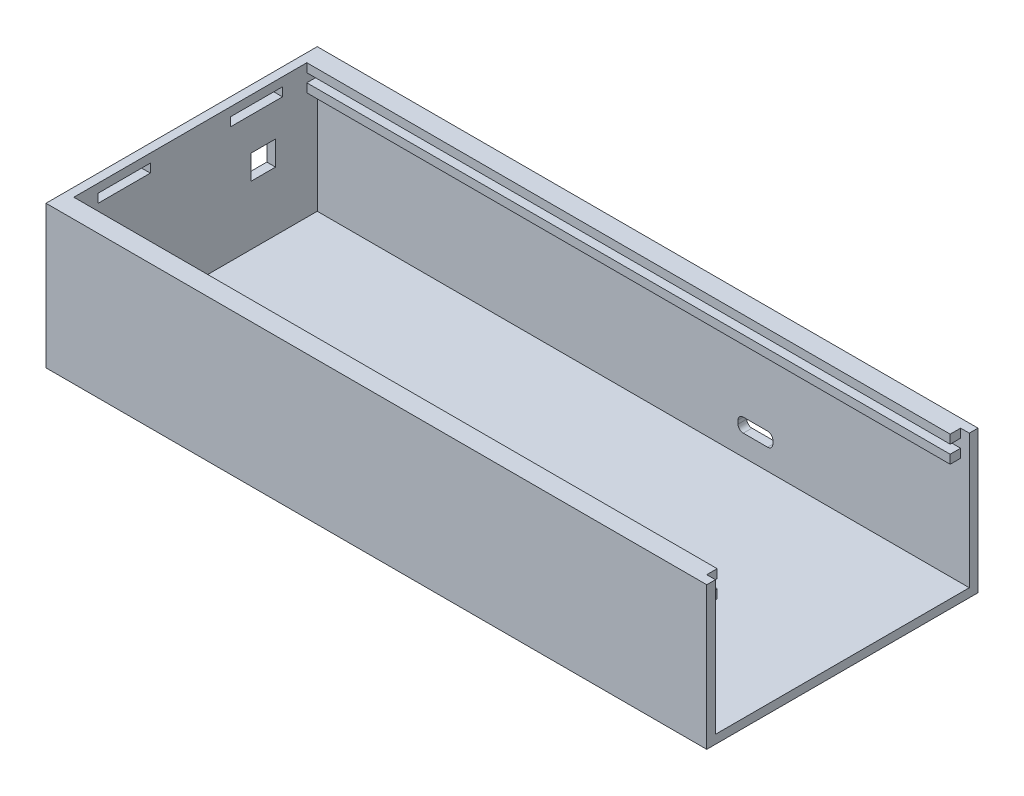
from build123d import *

# Parameters (mm, degrees)
SKETCH_1_W          = 190
SKETCH_1_H          = 78
EXTRUDE_1_DEPTH     = 41
SKETCH_2_W          = 185
SKETCH_2_H          = 73
CUT_EXTRUDE_1_DEPTH = 38.5
SKETCH_3_W          = 2.5
SKETCH_3_H          = 73
CUT_EXTRUDE_2_DEPTH = 38.5
SKETCH_4_W          = 7
SKETCH_4_H          = 7
CUT_EXTRUDE_4_DEPTH = 2.5
SKETCH_5_W          = 10
SKETCH_5_H          = 4
CUT_EXTRUDE_5_DEPTH = 2.5
FILLET_1_R          = 1.5
SKETCH_9_W          = 15
SKETCH_9_H          = 2.5
CUT_EXTRUDE_8_DEPTH = 2.5
SKETCH_10_W         = 185
SKETCH_10_H         = 2.5
EXTRUDE_2_DEPTH     = 3
SKETCH_11_W         = 185
SKETCH_11_H         = 2.5
EXTRUDE_3_DEPTH     = 3
SKETCH_12_W         = 185
SKETCH_12_H         = 2.5
EXTRUDE_4_DEPTH     = 3
SKETCH_13_W         = 185
SKETCH_13_H         = 2.5
EXTRUDE_5_DEPTH     = 3


with BuildPart() as part:
    # 草图1 → 凸台-拉伸1 (new body)
    with BuildSketch(Plane(origin=(0, 0, 0), x_dir=(1, 0, 0), z_dir=(0, 1, 0))):
        with Locations((11.192771084, -10.259036145)):
            Rectangle(SKETCH_1_W, SKETCH_1_H)
    extrude(amount=EXTRUDE_1_DEPTH)

    # 草图2 → 切除-拉伸1 (cut)
    with BuildSketch(Plane(origin=(0, 41, 0), x_dir=(1, 0, 0), z_dir=(0, 1, 0))):
        with Locations((11.192771084, -10.259036145)):
            Rectangle(SKETCH_2_W, SKETCH_2_H)
    extrude(amount=-CUT_EXTRUDE_1_DEPTH, mode=Mode.SUBTRACT)

    # 草图3 → 切除-拉伸2 (cut)
    with BuildSketch(Plane(origin=(0, 41, 0), x_dir=(1, 0, 0), z_dir=(0, 1, 0))):
        with Locations((104.942771084, -10.259036145)):
            Rectangle(SKETCH_3_W, SKETCH_3_H)
    extrude(amount=-CUT_EXTRUDE_2_DEPTH, mode=Mode.SUBTRACT)

    # 草图4 → 切除-拉伸4 (cut)
    with BuildSketch(Plane.ZY.offset(83.807228916)):
        with Locations((-10.740963855, 23)):
            Rectangle(SKETCH_4_W, SKETCH_4_H)
        with Locations((33.059036145, 23)):
            Rectangle(SKETCH_4_W, SKETCH_4_H)
    extrude(amount=-CUT_EXTRUDE_4_DEPTH, mode=Mode.SUBTRACT)

    # 草图5 → 切除-拉伸5 (cut)
    with BuildSketch(Plane(origin=(0, 0, -28.740963855), x_dir=(-1, 0, 0), z_dir=(0, 0, -1))):
        with Locations((-44.692771084, 10.5)):
            Rectangle(SKETCH_5_W, SKETCH_5_H)
    extrude(amount=-CUT_EXTRUDE_5_DEPTH, mode=Mode.SUBTRACT)

    # 圆角1
    fillet_1_edges = [part.edges().sort_by_distance(p)[0] for p in [
        (39.692771084, 12.5, -27.490963855),
        (39.692771084, 8.5, -27.490963855),
        (49.692771084, 8.5, -27.490963855),
        (49.692771084, 12.5, -27.490963855),
    ]]
    fillet(fillet_1_edges, radius=FILLET_1_R)

    # 草图9 → 切除-拉伸8 (cut)
    with BuildSketch(Plane(origin=(-81.307228916, 0, 0), x_dir=(0, 0, -1), z_dir=(1, 0, 0))):
        with Locations((-29.259036145, 37.25)):
            Rectangle(SKETCH_9_W, SKETCH_9_H)
        with Locations((8.740963855, 37.25)):
            Rectangle(SKETCH_9_W, SKETCH_9_H)
    extrude(amount=-CUT_EXTRUDE_8_DEPTH, mode=Mode.SUBTRACT)

    # 草图10 → 凸台-拉伸2 (add)
    with BuildSketch(Plane(origin=(0, 0, 46.759036145), x_dir=(-1, 0, 0), z_dir=(0, 0, -1))):
        with Locations((-11.192771084, 39.75)):
            Rectangle(SKETCH_10_W, SKETCH_10_H)
    extrude(amount=EXTRUDE_2_DEPTH)

    # 草图11 → 凸台-拉伸3 (add)
    with BuildSketch(Plane.XY.offset(-26.240963855)):
        with Locations((11.192771084, 39.75)):
            Rectangle(SKETCH_11_W, SKETCH_11_H)
    extrude(amount=EXTRUDE_3_DEPTH)

    # 草图12 → 凸台-拉伸4 (add)
    with BuildSketch(Plane(origin=(0, 0, 46.759036145), x_dir=(-1, 0, 0), z_dir=(0, 0, -1))):
        with Locations((-11.192771084, 34.75)):
            Rectangle(SKETCH_12_W, SKETCH_12_H)
    extrude(amount=EXTRUDE_4_DEPTH)

    # 草图13 → 凸台-拉伸5 (add)
    with BuildSketch(Plane.XY.offset(-26.240963855)):
        with Locations((11.192771084, 34.75)):
            Rectangle(SKETCH_13_W, SKETCH_13_H)
    extrude(amount=EXTRUDE_5_DEPTH)


solid = part.part
